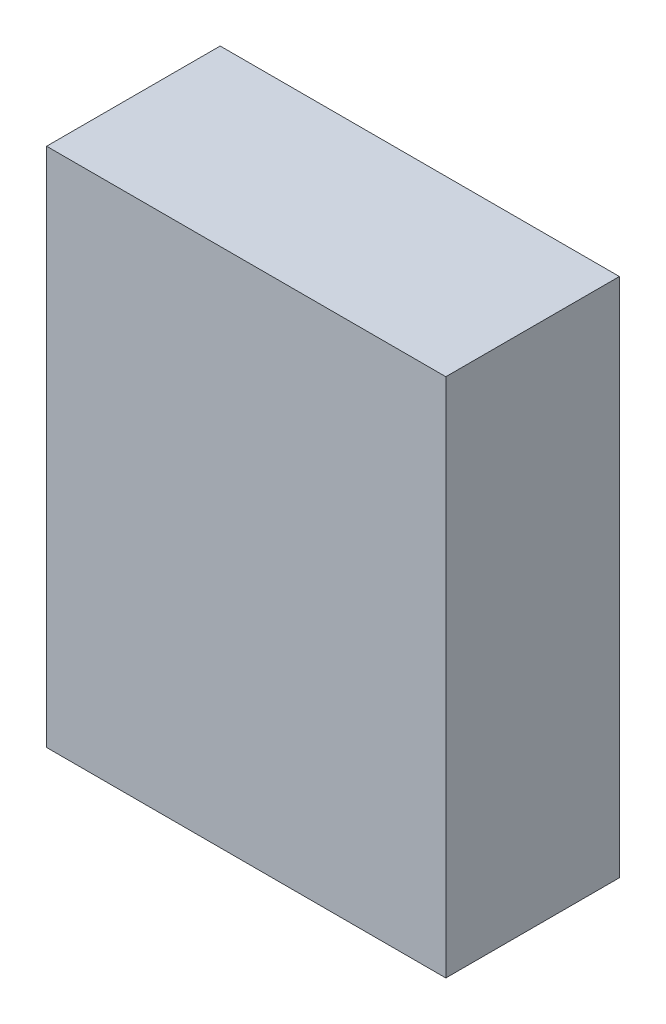
from build123d import *

# Parameters (mm, degrees)
ESQUISSE1_W        = 115
ESQUISSE1_H        = 150
BOSS_EXTRU_1_DEPTH = 50


with BuildPart() as part:
    # Esquisse1 → Boss.-Extru.1 (new body)
    with BuildSketch(Plane.XY):
        with Locations((9.018225078, -52.899659864)):
            Rectangle(ESQUISSE1_W, ESQUISSE1_H)
    extrude(amount=BOSS_EXTRU_1_DEPTH)


solid = part.part
